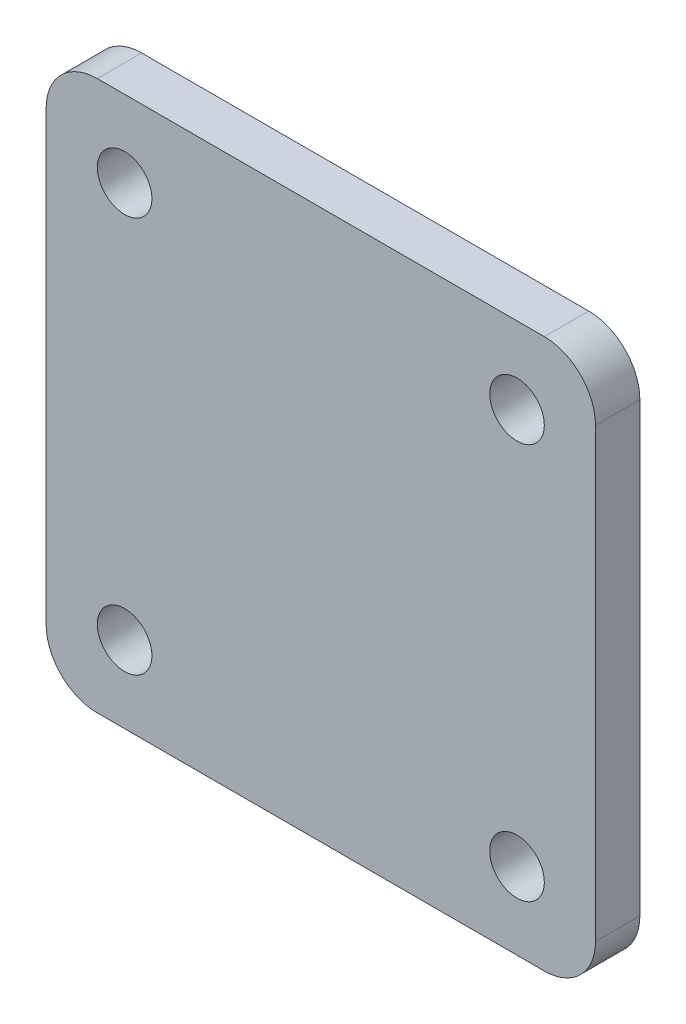
from build123d import *

# Parameters (mm, degrees)
SKETCH1_W           = 32.2
SKETCH1_H           = 32.2
SKETCH1_R           = 1.6
BOSS_EXTRUDE1_DEPTH = 2.6
FILLET1_R           = 3


with BuildPart() as part:
    # Sketch1 → Boss-Extrude1 (new body)
    with BuildSketch(Plane.XY):
        Rectangle(SKETCH1_W, SKETCH1_H)
        with Locations((-11.5, -11.6)):
            Circle(SKETCH1_R, mode=Mode.SUBTRACT)
        with Locations((-11.5, 11.6)):
            Circle(SKETCH1_R, mode=Mode.SUBTRACT)
        with Locations((11.5, 11.6)):
            Circle(SKETCH1_R, mode=Mode.SUBTRACT)
        with Locations((11.5, -11.6)):
            Circle(SKETCH1_R, mode=Mode.SUBTRACT)
    extrude(amount=BOSS_EXTRUDE1_DEPTH)

    # Fillet1
    fillet1_edges = [part.edges().sort_by_distance(p)[0] for p in [
        (16.1, -16.1, 1.3),
        (-16.1, -16.1, 1.3),
        (-16.1, 16.1, 1.3),
        (16.1, 16.1, 1.3),
    ]]
    fillet(fillet1_edges, radius=FILLET1_R)


solid = part.part
